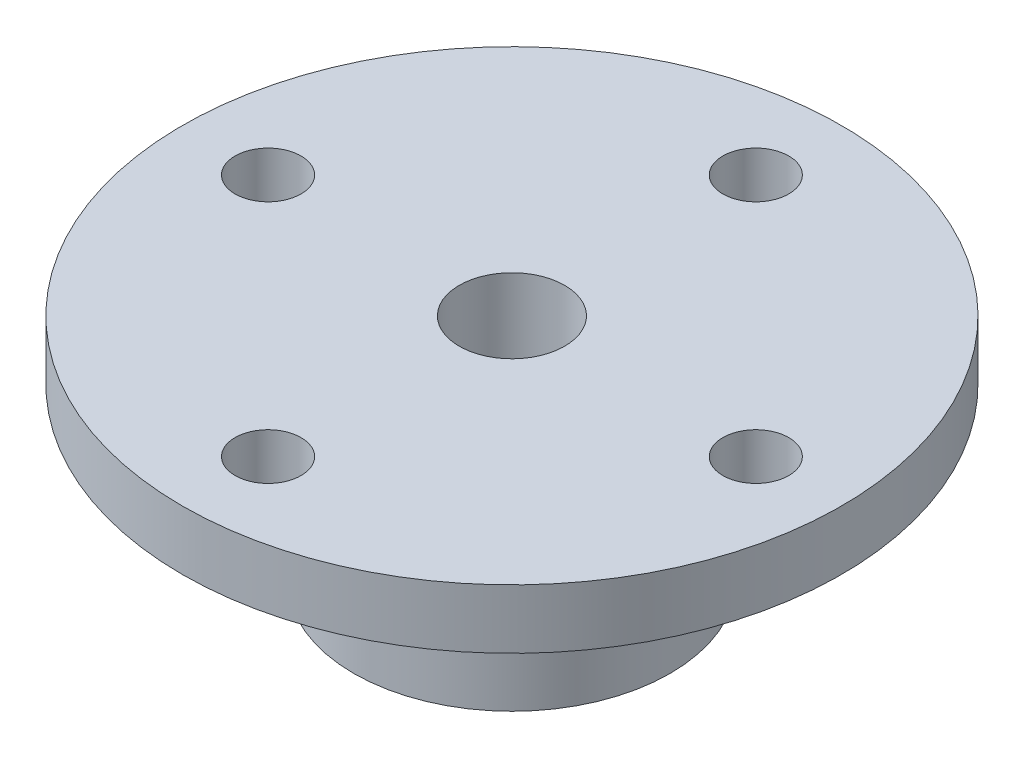
from build123d import *

# Parameters (mm, degrees)
SKETCH_1_R      = 12
SKETCH_1_R_2    = 4
EXTRUDE_1_DEPTH = 13
SKETCH_2_R      = 25
SKETCH_2_R_2    = 4
SKETCH_2_R_3    = 2.5
EXTRUDE_2_DEPTH = 4.5


with BuildPart() as part:
    # 草图1 → 凸台-拉伸1 (new body)
    with BuildSketch(Plane(origin=(0, 0, 0), x_dir=(1, 0, 0), z_dir=(0, 1, 0))):
        with Locations(Location((0, 0, 0), (0, 0, 90))):
            Circle(SKETCH_1_R)
        with Locations(Location((0, 0, 0), (0, 0, 90))):
            Circle(SKETCH_1_R_2, mode=Mode.SUBTRACT)
    extrude(amount=EXTRUDE_1_DEPTH)

    # 草图2 → 凸台-拉伸2 (add)
    with BuildSketch(Plane(origin=(0, 13, 0), x_dir=(1, 0, 0), z_dir=(0, 1, 0))):
        with Locations(Location((0, 0, 0), (0, 0, 270))):
            Circle(SKETCH_2_R)
        with Locations(Location((0, 0, 0), (0, 0, 90))):
            Circle(SKETCH_2_R_2, mode=Mode.SUBTRACT)
        with Locations(Location((0, 18.5, 0), (0, 0, 270))):
            Circle(SKETCH_2_R_3, mode=Mode.SUBTRACT)
        with Locations(Location((-18.5, 0, 0), (0, 0, 270))):
            Circle(SKETCH_2_R_3, mode=Mode.SUBTRACT)
        with Locations(Location((18.5, 0, 0), (0, 0, 270))):
            Circle(SKETCH_2_R_3, mode=Mode.SUBTRACT)
        with Locations(Location((0, -18.5, 0), (0, 0, 270))):
            Circle(SKETCH_2_R_3, mode=Mode.SUBTRACT)
    extrude(amount=EXTRUDE_2_DEPTH)


solid = part.part
